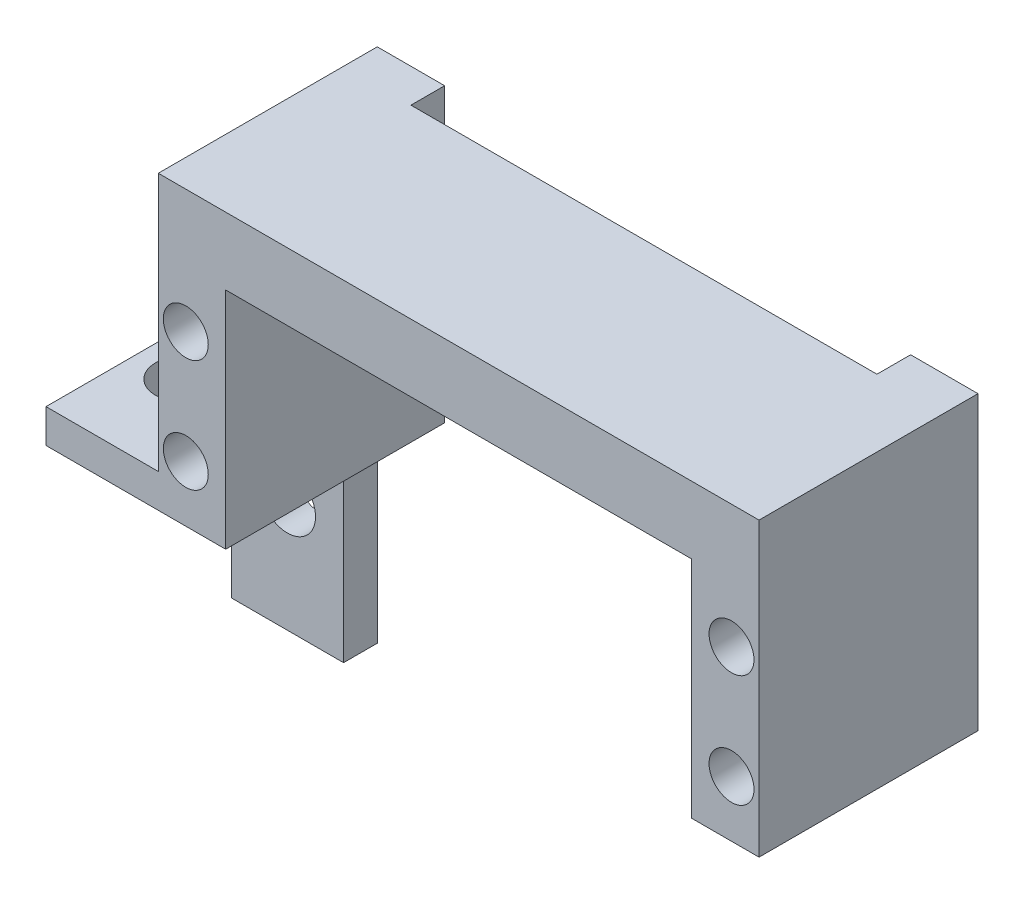
from build123d import *

# Parameters (mm, degrees)
EXTRUDE_1_DEPTH     = 16.5
SKETCH_2_R          = 2.5
CUT_EXTRUDE_1_DEPTH = 16.5
SKETCH_3_W          = 10
SKETCH_3_H          = 16.5
CUT_EXTRUDE_2_DEPTH = 3
SKETCH_4_W          = 11.896315449
SKETCH_4_H          = 29.084641161
CUT_EXTRUDE_3_DEPTH = 48.945933091
SKETCH_5_R          = 2
CUT_EXTRUDE_4_DEPTH = 48.945933091
SKETCH_6_W          = 10
SKETCH_6_H          = 23
EXTRUDE_2_DEPTH     = 3
SKETCH_7_R          = 2.5
CUT_EXTRUDE_5_DEPTH = 3
EXTRUDE_START       = 3
SKETCH_8_R          = 2
SKETCH_8_W          = 6
SKETCH_8_H          = 26
EXTRUDE_3_DEPTH     = 3
SKETCH_9_R          = 2.5
CUT_EXTRUDE_6_DEPTH = 3
SKETCH_10_W         = 74.694005649
SKETCH_10_H         = 52.095093629
CUT_EXTRUDE_7_DEPTH = 116.604119736
SKETCH_11_W         = 16.482634167
SKETCH_11_H         = 25.810545036
CUT_EXTRUDE_8_DEPTH = 10


with BuildPart() as part:
    # 草图1 → 凸台-拉伸1 (new body)
    with BuildSketch(Plane.XY):
        Polygon((0, 0), (26.75, 0), (26.75, -20), (36.75, -20), (36.75, -26), (20.75, -26), (20.75, -6), (0, -6), (-20.75, -6), (-20.75, -26), (-36.75, -26), (-36.75, -20), (-26.75, -20), (-26.75, 0), align=None)
    extrude(amount=EXTRUDE_1_DEPTH)

    # 草图2 → 切除-拉伸1 (cut)
    with BuildSketch(Plane(origin=(0, -20, 0), x_dir=(1, 0, 0), z_dir=(0, 1, 0))):
        with Locations(Location((32.75, -8.25, 0), (0, 0, 270))):
            Circle(SKETCH_2_R)
    extrude(amount=-CUT_EXTRUDE_1_DEPTH, mode=Mode.SUBTRACT)

    # 草图3 → 切除-拉伸2 (cut)
    with BuildSketch(Plane(origin=(0, -20, 0), x_dir=(1, 0, 0), z_dir=(0, 1, 0))):
        with Locations((31.75, -8.25)):
            Rectangle(SKETCH_3_W, SKETCH_3_H)
    extrude(amount=-CUT_EXTRUDE_2_DEPTH, mode=Mode.SUBTRACT)

    # 草图4 → 切除-拉伸3 (cut, through all)
    with BuildSketch(Plane.XY.offset(16.5)):
        with Locations((-32.698157724, -14.542320581)):
            Rectangle(SKETCH_4_W, SKETCH_4_H)
    extrude(amount=-CUT_EXTRUDE_3_DEPTH, mode=Mode.SUBTRACT)

    # 草图5 → 切除-拉伸4 (cut, through all)
    with BuildSketch(Plane(origin=(0, 0, 0), x_dir=(-1, 0, 0), z_dir=(0, 0, -1))):
        with Locations((-24.3, -11)):
            Circle(SKETCH_5_R)
        with Locations((-24.3, -21)):
            Circle(SKETCH_5_R)
        with Locations(Location((24.3, -21, 0), (0, 0, 180))):
            Circle(SKETCH_5_R)
        with Locations(Location((24.3, -11, 0), (0, 0, 180))):
            Circle(SKETCH_5_R)
    extrude(amount=-CUT_EXTRUDE_4_DEPTH, mode=Mode.SUBTRACT)

    # 草图6 → 凸台-拉伸2 (add)
    with BuildSketch(Plane(origin=(0, 0, 0), x_dir=(-1, 0, 0), z_dir=(0, 0, -1))):
        with Locations((-31.75, -34.5)):
            Rectangle(SKETCH_6_W, SKETCH_6_H)
    extrude(amount=EXTRUDE_2_DEPTH)

    # 草图7 → 切除-拉伸5 (cut)
    with BuildSketch(Plane(origin=(0, 0, -3), x_dir=(-1, 0, 0), z_dir=(0, 0, -1))):
        with Locations((-31.75, -36)):
            Circle(SKETCH_7_R)
    extrude(amount=-CUT_EXTRUDE_5_DEPTH, mode=Mode.SUBTRACT)

    # 草图8 → 凸台-拉伸3 (add)
    # profile 1 of 2: a face of its own
    with BuildSketch(Plane(origin=(0, 0, 0), x_dir=(-1, 0, 0), z_dir=(0, 0, -1)).offset(EXTRUDE_START)):
        Polygon((26.75, 0), (20.75, 0), (20.75, -46), (26.75, -46), (30.75, -46), (30.75, -26), (26.75, -26), align=None)
        with Locations((24.3, -21)):
            Circle(SKETCH_8_R, mode=Mode.SUBTRACT)
        with Locations((24.3, -11)):
            Circle(SKETCH_8_R, mode=Mode.SUBTRACT)
    # profile 2 of 2: a face of its own
    with BuildSketch(Plane(origin=(0, 0, 0), x_dir=(-1, 0, 0), z_dir=(0, 0, -1)).offset(EXTRUDE_START)):
        with Locations((-23.75, -13)):
            Rectangle(SKETCH_8_W, SKETCH_8_H)
        with Locations((-24.3, -11)):
            Circle(SKETCH_8_R, mode=Mode.SUBTRACT)
        with Locations((-24.3, -21)):
            Circle(SKETCH_8_R, mode=Mode.SUBTRACT)
    extrude(amount=-EXTRUDE_3_DEPTH)

    # 草图9 → 切除-拉伸6 (cut)
    with BuildSketch(Plane(origin=(0, 0, -3), x_dir=(-1, 0, 0), z_dir=(0, 0, -1))):
        with Locations((25.75, -36)):
            Circle(SKETCH_9_R)
    extrude(amount=-CUT_EXTRUDE_6_DEPTH, mode=Mode.SUBTRACT)

    # 镜向1: part across plane


with BuildPart() as part_1:
    add(part.part)
    add(part.part.mirror(Plane(origin=(36.75, -20, 16.5), x_dir=(0, 0, 1), z_dir=(-1, 0, 0))))

    # 草图10 → 切除-拉伸7 (cut, through all)
    with BuildSketch(Plane(origin=(0, 0, -3), x_dir=(-1, 0, 0), z_dir=(0, 0, -1))):
        with Locations((0.597002825, -19.952453186)):
            Rectangle(SKETCH_10_W, SKETCH_10_H)
    extrude(amount=-CUT_EXTRUDE_7_DEPTH, mode=Mode.SUBTRACT)

    # 草图11 → 切除-拉伸8 (cut)
    with BuildSketch(Plane(origin=(0, 0, -3), x_dir=(-1, 0, 0), z_dir=(0, 0, -1))):
        with Locations((-102.491317084, -38.905272518)):
            Rectangle(SKETCH_11_W, SKETCH_11_H)
    extrude(amount=-CUT_EXTRUDE_8_DEPTH, mode=Mode.SUBTRACT)


solid = part_1.part
